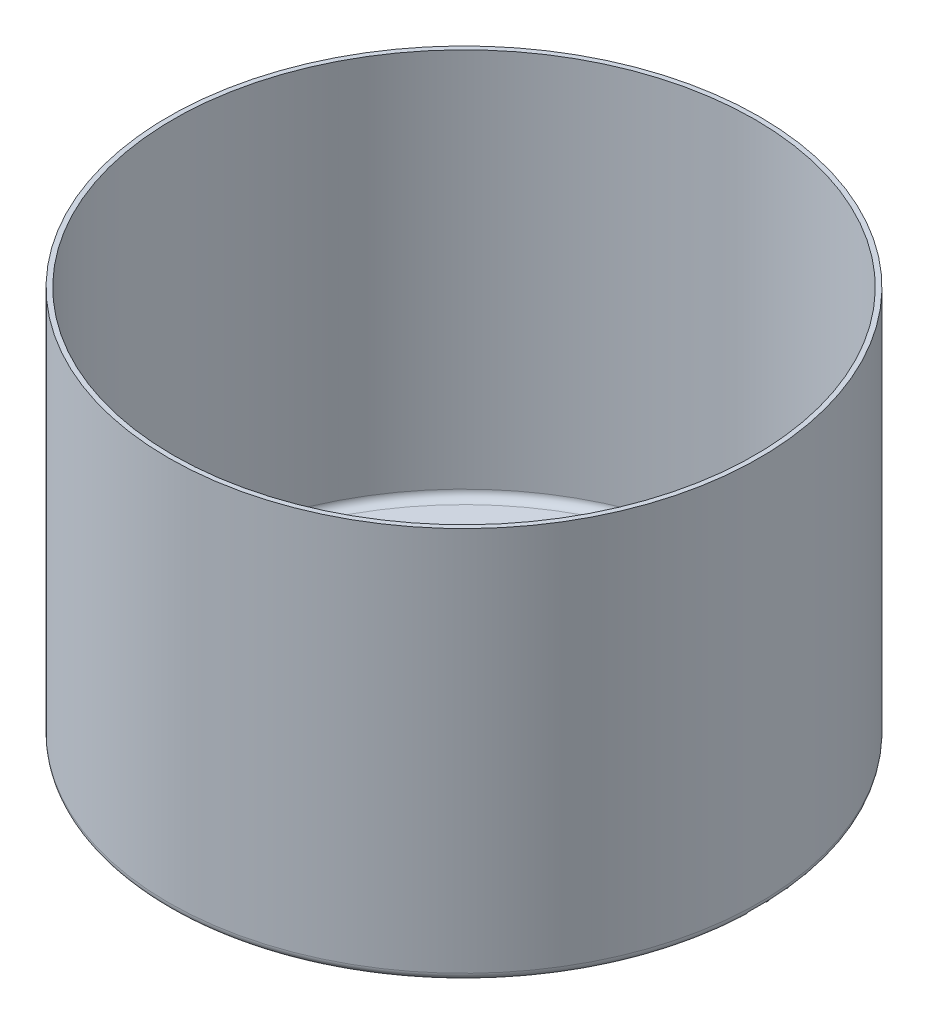
from build123d import *

# Parameters (mm, degrees)
CUT_EXTRUDE2_REACH = 187.394
MOTOR_HOLE_R       = 18.415
MOTOR_HOLE_R_2     = 3.25
FILLET1_R          = 2.54


with BuildPart() as part:
    # Compartment → Revolve1 (revolve)
    with BuildSketch(Plane.XY, mode=Mode.PRIVATE) as revolve1_sk:
        Polygon((95.504, -80), (0, -80), (0, -78.476), (93.98, -78.476), (93.98, 47), (95.504, 47), align=None)
    revolve(revolve1_sk.sketch.rotate(Axis((0, 0, 0), (0, 1, 0)), 90), axis=Axis((0, 0, 0), (0, 1, 0)))

    # Motor Hole → Cut-Extrude2 (cut, up to next)
    with BuildSketch(Plane.XZ.offset(80), mode=Mode.PRIVATE) as cut_extrude2_sk1:
        with Locations(Location((0, 0, 0), (0, 0, 270))):
            Circle(MOTOR_HOLE_R)
    cut_extrude2_tool1 = extrude(cut_extrude2_sk1.sketch, amount=-CUT_EXTRUDE2_REACH, mode=Mode.PRIVATE) & part.part
    # Motor Hole → Cut-Extrude2 (cut, up to next)
    with BuildSketch(Plane.XZ.offset(80), mode=Mode.PRIVATE) as cut_extrude2_sk2:
        with Locations(Location((0, 63.5, 0), (0, 0, 270))):
            Circle(MOTOR_HOLE_R_2)
    cut_extrude2_tool2 = extrude(cut_extrude2_sk2.sketch, amount=-CUT_EXTRUDE2_REACH, mode=Mode.PRIVATE) & part.part
    # Motor Hole → Cut-Extrude2 (cut, up to next)
    with BuildSketch(Plane.XZ.offset(80), mode=Mode.PRIVATE) as cut_extrude2_sk3:
        with Locations(Location((63.5, 0, 0), (0, 0, 270))):
            Circle(MOTOR_HOLE_R_2)
    cut_extrude2_tool3 = extrude(cut_extrude2_sk3.sketch, amount=-CUT_EXTRUDE2_REACH, mode=Mode.PRIVATE) & part.part
    # Motor Hole → Cut-Extrude2 (cut, up to next)
    with BuildSketch(Plane.XZ.offset(80), mode=Mode.PRIVATE) as cut_extrude2_sk4:
        with Locations(Location((0, -63.5, 0), (0, 0, 270))):
            Circle(MOTOR_HOLE_R_2)
    cut_extrude2_tool4 = extrude(cut_extrude2_sk4.sketch, amount=-CUT_EXTRUDE2_REACH, mode=Mode.PRIVATE) & part.part
    # Motor Hole → Cut-Extrude2 (cut, up to next)
    with BuildSketch(Plane.XZ.offset(80), mode=Mode.PRIVATE) as cut_extrude2_sk5:
        with Locations(Location((-63.5, 0, 0), (0, 0, 270))):
            Circle(MOTOR_HOLE_R_2)
    cut_extrude2_tool5 = extrude(cut_extrude2_sk5.sketch, amount=-CUT_EXTRUDE2_REACH, mode=Mode.PRIVATE) & part.part
    add(cut_extrude2_tool1.solids().sort_by_distance((0, -80, 0))[0], mode=Mode.SUBTRACT)
    add(cut_extrude2_tool2.solids().sort_by_distance((0, -80, 63.5))[0], mode=Mode.SUBTRACT)
    add(cut_extrude2_tool3.solids().sort_by_distance((63.5, -80, 0))[0], mode=Mode.SUBTRACT)
    add(cut_extrude2_tool4.solids().sort_by_distance((0, -80, -63.5))[0], mode=Mode.SUBTRACT)
    add(cut_extrude2_tool5.solids().sort_by_distance((-63.5, -80, 0))[0], mode=Mode.SUBTRACT)

    # Fillet1
    fillet1_edges = [part.edges().sort_by_distance(p)[0] for p in [
        (0, -78.476, 93.98),
        (0, -80, 95.504),
    ]]
    fillet(fillet1_edges, radius=FILLET1_R)


solid = part.part
